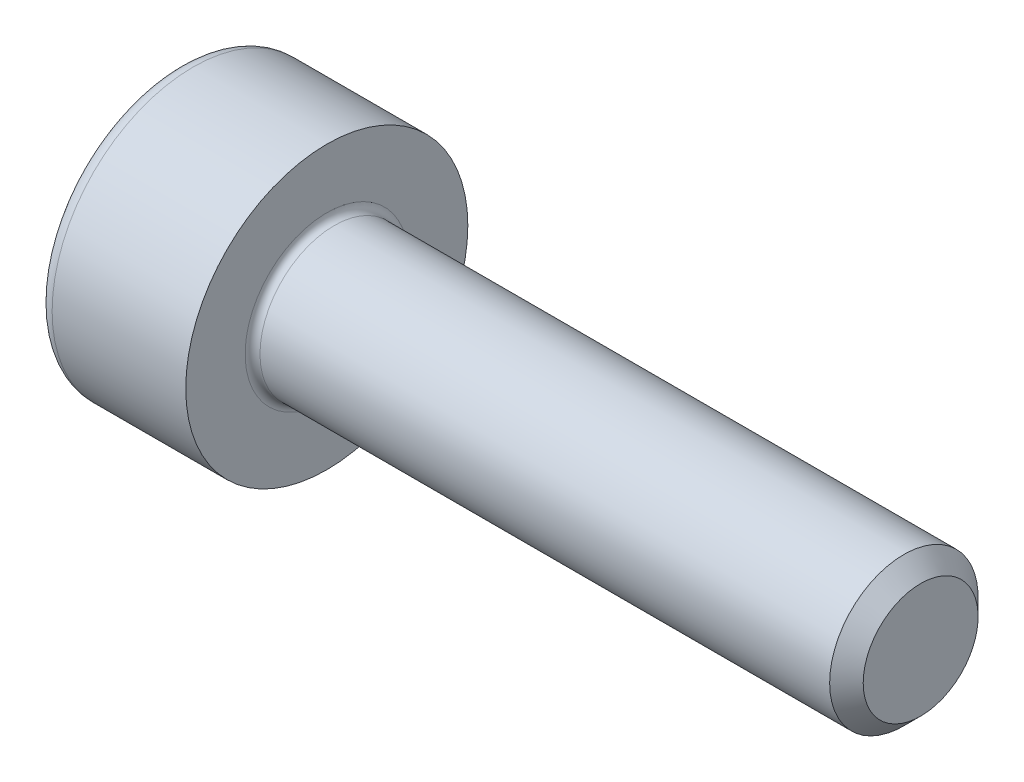
from build123d import *

# Parameters (mm, degrees)
FILLET1_R   = 0.1
FILLET2_R   = 0.2
HEX_2_DEPTH = 1


with BuildPart() as part:
    # BodySke → Base-Revolve (revolve)
    with BuildSketch(Plane.XY, mode=Mode.PRIVATE) as base_revolve_sk:
        Polygon((0, 0), (0, 1.9), (2, 1.9), (2, 1), (9.774, 1), (10, 0.774), (10, 0), align=None)
    revolve(base_revolve_sk.sketch.rotate(Axis((-31.75, 0, 0), (1, 0, 0)), 90), axis=Axis((-31.75, 0, 0), (1, 0, 0)))

    # Fillet1
    fillet1_edges = [part.edges().sort_by_distance(p)[0] for p in [
        (2, 0, -1),
    ]]
    fillet(fillet1_edges, radius=FILLET1_R)

    # Fillet2
    fillet2_edges = [part.edges().sort_by_distance(p)[0] for p in [
        (0, 0, -1.9),
    ]]
    fillet(fillet2_edges, radius=FILLET2_R)

    # Sketch2 → Hex-PreBroach (revolve, cut)
    with BuildSketch(Plane.XY, mode=Mode.PRIVATE) as hex_prebroach_sk:
        Polygon((0, 0.76), (1, 0.76), (1.438786205, 0), (0, 0), align=None)
    revolve(hex_prebroach_sk.sketch.rotate(Axis((0, 0, 0), (1, 0, 0)), 90), axis=Axis((0, 0, 0), (1, 0, 0)), mode=Mode.SUBTRACT)

    # Sketch3 → Hex 2 (cut)
    with BuildSketch(Plane(origin=(0, 0, 0), x_dir=(0, 0.500000000000001, 0.866025403784438), z_dir=(-1, 0, 0))):
        Polygon((0.438786205, 0.76), (-0.438786205, 0.76), (-0.877572409, 0), (-0.438786205, -0.76), (0.438786205, -0.76), (0.877572409, 0), align=None)
    extrude(amount=-HEX_2_DEPTH, mode=Mode.SUBTRACT)


solid = part.part
